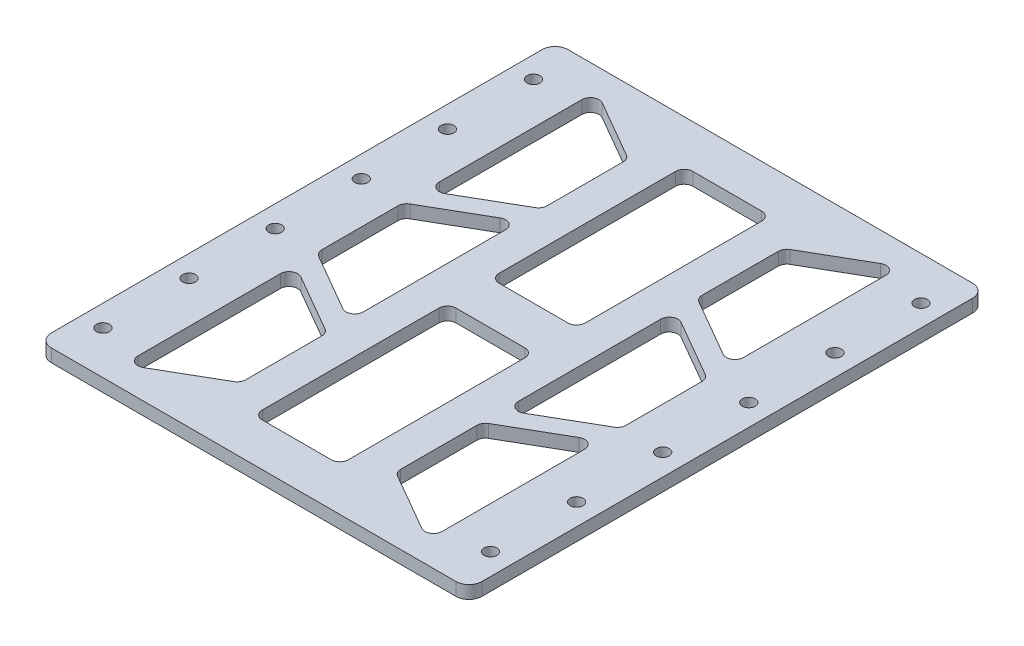
from build123d import *

# Parameters (mm, degrees)
SKETCH_1_W      = 100
SKETCH_1_H      = 120
SKETCH_1_R      = 1.5
SKETCH_1_W_2    = 20
SKETCH_1_H_2    = 45
EXTRUDE_1_DEPTH = 3
FILLET_1_R      = 3
FILLET_2_R      = 2


with BuildPart() as part:
    # 草图1 → 凸台-拉伸1 (new body)
    with BuildSketch(Plane(origin=(0, 0, 0), x_dir=(1, 0, 0), z_dir=(0, 1, 0))):
        Rectangle(SKETCH_1_W, SKETCH_1_H)
        with Locations(Location((-45, -50, 0), (0, 0, 270))):
            Circle(SKETCH_1_R, mode=Mode.SUBTRACT)
        with Locations(Location((-45, -30, 0), (0, 0, 270))):
            Circle(SKETCH_1_R, mode=Mode.SUBTRACT)
        Polygon((-35.320508076, -15), (-18, -25), (-18, -45), (-35.320508076, -55), align=None, mode=Mode.SUBTRACT)
        with Locations(Location((-45, -10, 0), (0, 0, 270))):
            Circle(SKETCH_1_R, mode=Mode.SUBTRACT)
        Polygon((-35.320508076, -10), (-35.320508076, 10), (-18, 20), (-18, -20), align=None, mode=Mode.SUBTRACT)
        with Locations((0, -27.5)):
            Rectangle(SKETCH_1_W_2, SKETCH_1_H_2, mode=Mode.SUBTRACT)
        with Locations((0, 27.5)):
            Rectangle(SKETCH_1_W_2, SKETCH_1_H_2, mode=Mode.SUBTRACT)
        with Locations(Location((45, -50, 0), (0, 0, 270))):
            Circle(SKETCH_1_R, mode=Mode.SUBTRACT)
        Polygon((18, -25), (35.320508076, -15), (35.320508076, -55), (18, -45), align=None, mode=Mode.SUBTRACT)
        with Locations(Location((45, -30, 0), (0, 0, 270))):
            Circle(SKETCH_1_R, mode=Mode.SUBTRACT)
        Polygon((35.320508076, -10), (18, -20), (18, 20), (35.320508076, 10), align=None, mode=Mode.SUBTRACT)
        with Locations(Location((45, -10, 0), (0, 0, 270))):
            Circle(SKETCH_1_R, mode=Mode.SUBTRACT)
        with Locations(Location((-45, 10, 0), (0, 0, 270))):
            Circle(SKETCH_1_R, mode=Mode.SUBTRACT)
        with Locations(Location((-45, 30, 0), (0, 0, 270))):
            Circle(SKETCH_1_R, mode=Mode.SUBTRACT)
        Polygon((-35.320508076, 15), (-35.320508076, 55), (-18, 45), (-18, 25), align=None, mode=Mode.SUBTRACT)
        with Locations(Location((-45, 50, 0), (0, 0, 270))):
            Circle(SKETCH_1_R, mode=Mode.SUBTRACT)
        with Locations(Location((45, 10, 0), (0, 0, 270))):
            Circle(SKETCH_1_R, mode=Mode.SUBTRACT)
        with Locations(Location((45, 30, 0), (0, 0, 270))):
            Circle(SKETCH_1_R, mode=Mode.SUBTRACT)
        Polygon((35.320508076, 15), (18, 25), (18, 45), (35.320508076, 55), align=None, mode=Mode.SUBTRACT)
        with Locations(Location((45, 50, 0), (0, 0, 270))):
            Circle(SKETCH_1_R, mode=Mode.SUBTRACT)
    extrude(amount=EXTRUDE_1_DEPTH)

    # 圆角1
    fillet_1_edges = [part.edges().sort_by_distance(p)[0] for p in [
        (-50, 1.5, 60),
        (-50, 1.5, -60),
        (50, 1.5, -60),
        (50, 1.5, 60),
    ]]
    fillet(fillet_1_edges, radius=FILLET_1_R)

    # 圆角2
    fillet_2_edges = [part.edges().sort_by_distance(p)[0] for p in [
        (18, 1.5, -25),
        (35.320508076, 1.5, -15),
        (35.320508076, 1.5, -55),
        (18, 1.5, -45),
        (18, 1.5, 20),
        (35.320508076, 1.5, 10),
        (35.320508076, 1.5, -10),
        (18, 1.5, -20),
        (-18, 1.5, 25),
        (-35.320508076, 1.5, 15),
        (-35.320508076, 1.5, 55),
        (-18, 1.5, 45),
        (-35.320508076, 1.5, -55),
        (-35.320508076, 1.5, -15),
        (-18, 1.5, -25),
        (-18, 1.5, -45),
        (-35.320508076, 1.5, -10),
        (-35.320508076, 1.5, 10),
        (-18, 1.5, 20),
        (-18, 1.5, -20),
        (18, 1.5, 45),
        (35.320508076, 1.5, 55),
        (35.320508076, 1.5, 15),
        (18, 1.5, 25),
        (10, 1.5, 5),
        (-10, 1.5, 5),
        (-10, 1.5, 50),
        (10, 1.5, 50),
        (10, 1.5, -50),
        (-10, 1.5, -50),
        (-10, 1.5, -5),
        (10, 1.5, -5),
    ]]
    fillet(fillet_2_edges, radius=FILLET_2_R)


solid = part.part
